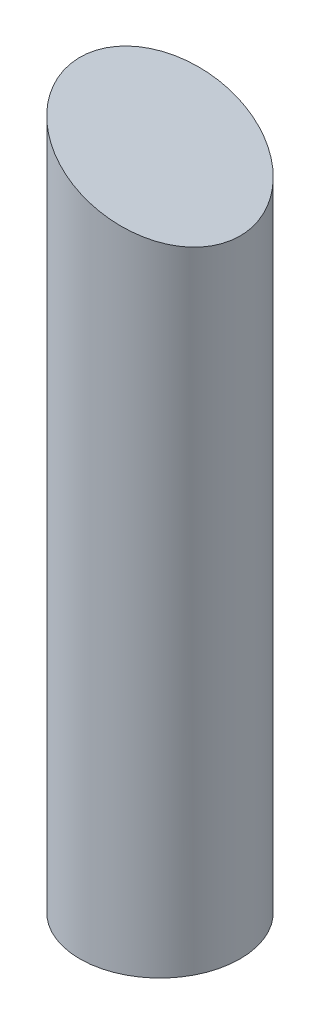
from build123d import *

# Parameters (mm, degrees)
CROQUIS1_R              = 4
SALIENTE_EXTRUIR1_DEPTH = 35
CORTAR_EXTRUIR1_DEPTH   = 10


with BuildPart() as part:
    # Croquis1 → Saliente-Extruir1 (new body)
    with BuildSketch(Plane(origin=(0, 0, 0), x_dir=(1, 0, 0), z_dir=(0, 1, 0))):
        with Locations(Location((0, 0, 0), (0, 0, 270))):
            Circle(CROQUIS1_R)
    extrude(amount=SALIENTE_EXTRUIR1_DEPTH)

    # Croquis2 → Cortar-Extruir1 (cut)
    with BuildSketch(Plane.XY.offset(4)):
        Polygon((-4, 35), (4, 31.269538735), (4, 35), align=None)
    extrude(amount=-CORTAR_EXTRUIR1_DEPTH, mode=Mode.SUBTRACT)


solid = part.part
